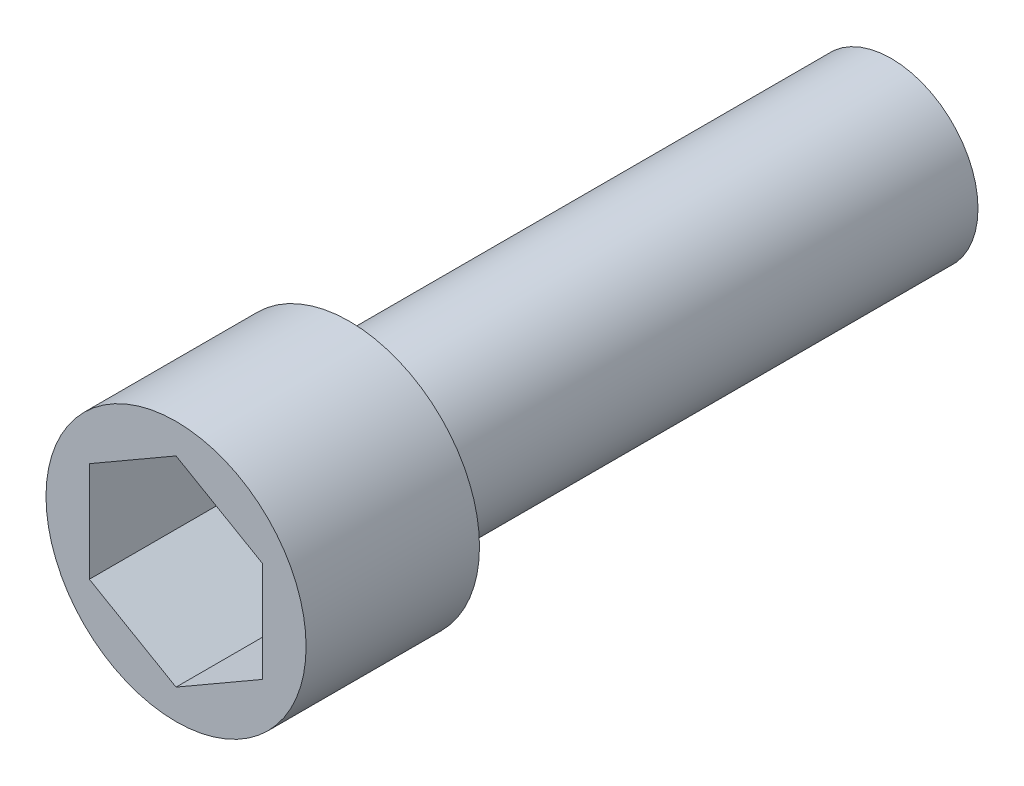
from build123d import *

# Parameters (mm, degrees)
SKETCH1_R           = 6
BOSS_EXTRUDE1_DEPTH = 8
SKETCH1_3_R         = 4
BOSS_EXTRUDE2_DEPTH = 33
CUT_EXTRUDE1_DEPTH  = 6


with BuildPart() as part:
    # Sketch1 → Boss-Extrude1 (new body)
    with BuildSketch(Plane.XY):
        Circle(SKETCH1_R)
    extrude(amount=-BOSS_EXTRUDE1_DEPTH)

    # Sketch1<3> → Boss-Extrude2 (add)
    with BuildSketch(Plane.XY):
        Circle(SKETCH1_3_R)
    extrude(amount=-BOSS_EXTRUDE2_DEPTH)

    # Sketch1<4> → Cut-Extrude1 (cut)
    with BuildSketch(Plane.XY):
        Polygon((0, 4.618802154), (-4, 2.309401077), (-4, -2.309401077), (0, -4.618802154), (4, -2.309401077), (4, 2.309401077), align=None)
    extrude(amount=-CUT_EXTRUDE1_DEPTH, mode=Mode.SUBTRACT)


solid = part.part
